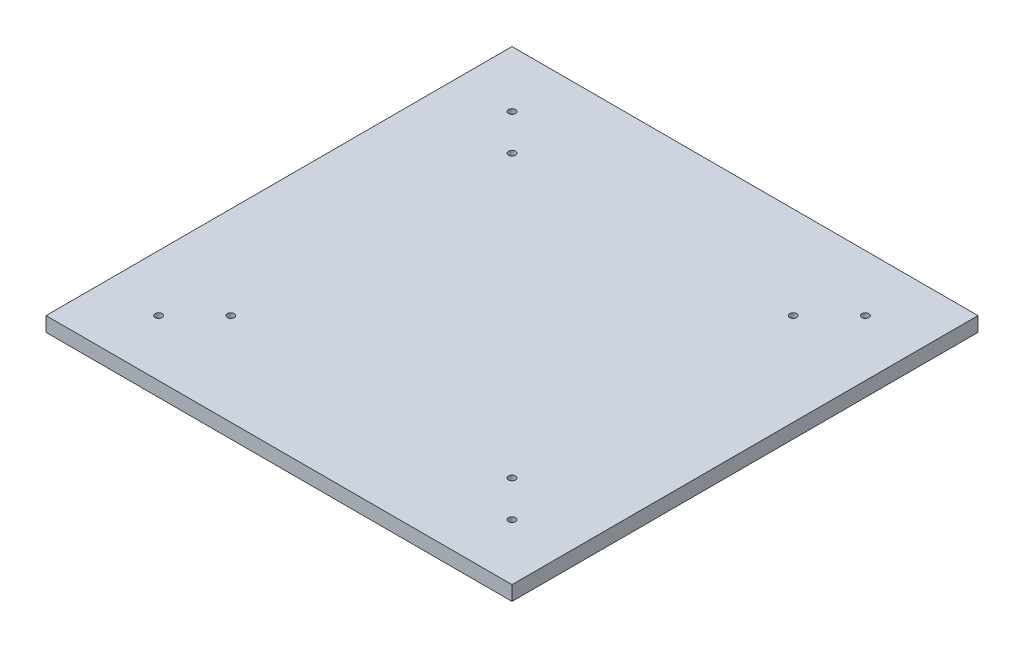
from build123d import *

# Parameters (mm, degrees)
SKETCH1_W           = 160
SKETCH1_H           = 160
SKETCH1_R           = 1.2
BOSS_EXTRUDE1_DEPTH = 5


with BuildPart() as part:
    # Sketch1 → Boss-Extrude1 (new body)
    with BuildSketch(Plane(origin=(0, 0, 0), x_dir=(1, 0, 0), z_dir=(0, 1, 0))):
        Rectangle(SKETCH1_W, SKETCH1_H)
        with Locations(Location((-60.664206642, 60.664206642, 0), (0, 0, 270))):
            Circle(SKETCH1_R, mode=Mode.SUBTRACT)
        with Locations(Location((-48.279552135, 48.279552135, 0), (0, 0, 270))):
            Circle(SKETCH1_R, mode=Mode.SUBTRACT)
        with Locations(Location((48.279552135, 48.279552135, 0), (0, 0, 90))):
            Circle(SKETCH1_R, mode=Mode.SUBTRACT)
        with Locations(Location((60.664206642, 60.664206642, 0), (0, 0, 90))):
            Circle(SKETCH1_R, mode=Mode.SUBTRACT)
        with Locations(Location((60.664206642, -60.664206642, 0), (0, 0, 270))):
            Circle(SKETCH1_R, mode=Mode.SUBTRACT)
        with Locations(Location((48.279552135, -48.279552135, 0), (0, 0, 270))):
            Circle(SKETCH1_R, mode=Mode.SUBTRACT)
        with Locations(Location((-48.279552135, -48.279552135, 0), (0, 0, 90))):
            Circle(SKETCH1_R, mode=Mode.SUBTRACT)
        with Locations(Location((-60.664206642, -60.664206642, 0), (0, 0, 90))):
            Circle(SKETCH1_R, mode=Mode.SUBTRACT)
    extrude(amount=BOSS_EXTRUDE1_DEPTH)


solid = part.part
